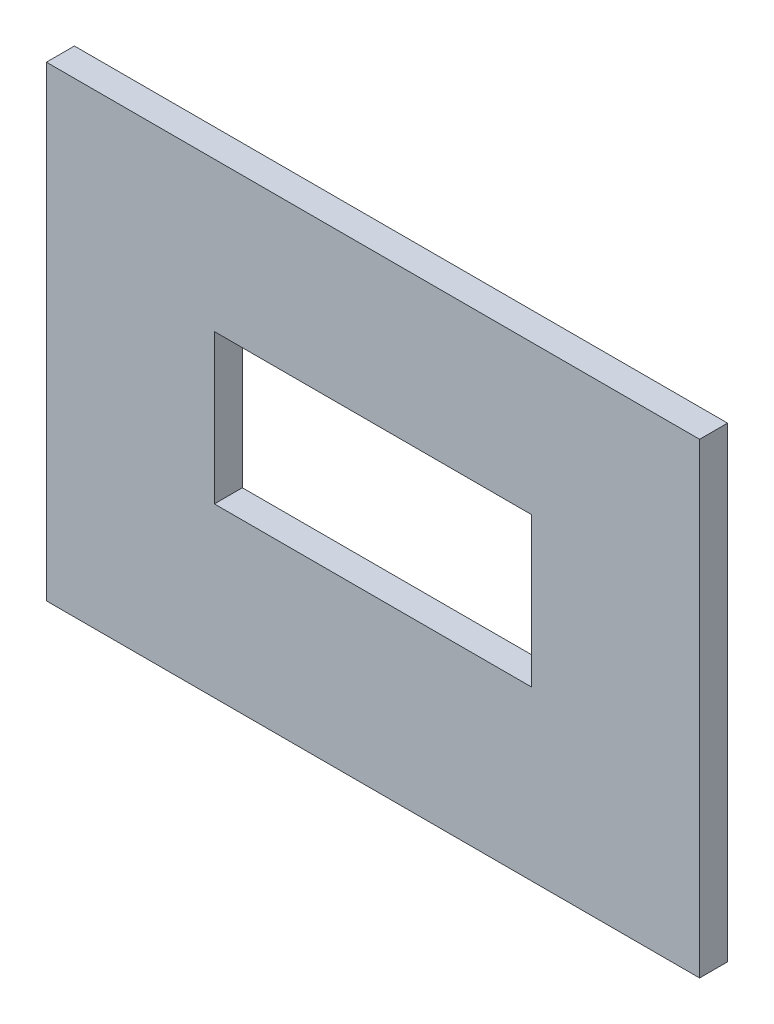
from build123d import *

# Parameters (mm, degrees)
SKETCH_1_W      = 34
SKETCH_1_H      = 16
EXTRUDE_2_DEPTH = 3


with BuildPart() as part:
    # 草图1 → 凸台-拉伸2 (new body)
    with BuildSketch(Plane.XY):
        Polygon((0, 0), (0, 50), (70, 50), (70, 0), (54, 0), (16, 0), align=None)
        with Locations((35, 26)):
            Rectangle(SKETCH_1_W, SKETCH_1_H, mode=Mode.SUBTRACT)
    extrude(amount=EXTRUDE_2_DEPTH)


solid = part.part
